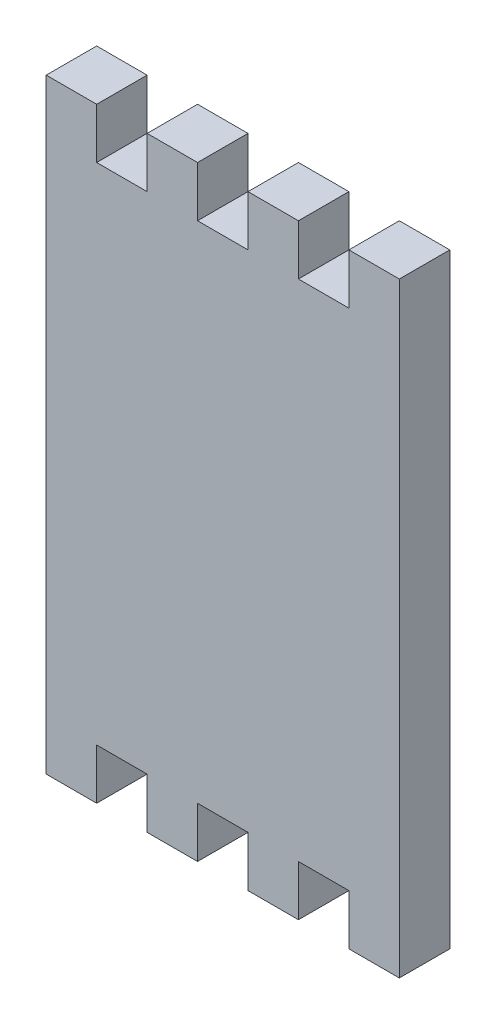
from build123d import *

# Parameters (mm, degrees)
BOSS_EXTRUDE1_DEPTH = 3


with BuildPart() as part:
    # Sketch1 → Boss-Extrude1 (new body)
    with BuildSketch(Plane.XY):
        Polygon((12.616389134, 16.179892371), (15.616389134, 16.179892371), (15.616389134, 13.179892371), (18.616389134, 13.179892371), (18.616389134, 16.179892371), (21.616389134, 16.179892371), (21.616389134, 13.179892371), (24.616389134, 13.179892371), (24.616389134, 16.179892371), (27.616389134, 16.179892371), (27.616389134, 13.179892371), (30.616389134, 13.179892371), (30.616389134, 16.179892371), (33.616389134, 16.179892371), (33.616389134, -19.820107629), (30.616389134, -19.820107629), (30.616389134, -16.820107629), (27.616389134, -16.820107629), (27.616389134, -19.820107629), (24.616389134, -19.820107629), (24.616389134, -16.820107629), (21.616389134, -16.820107629), (21.616389134, -19.820107629), (18.616389134, -19.820107629), (18.616389134, -16.820107629), (15.616389134, -16.820107629), (15.616389134, -19.820107629), (12.616389134, -19.820107629), align=None)
    extrude(amount=BOSS_EXTRUDE1_DEPTH)


solid = part.part
